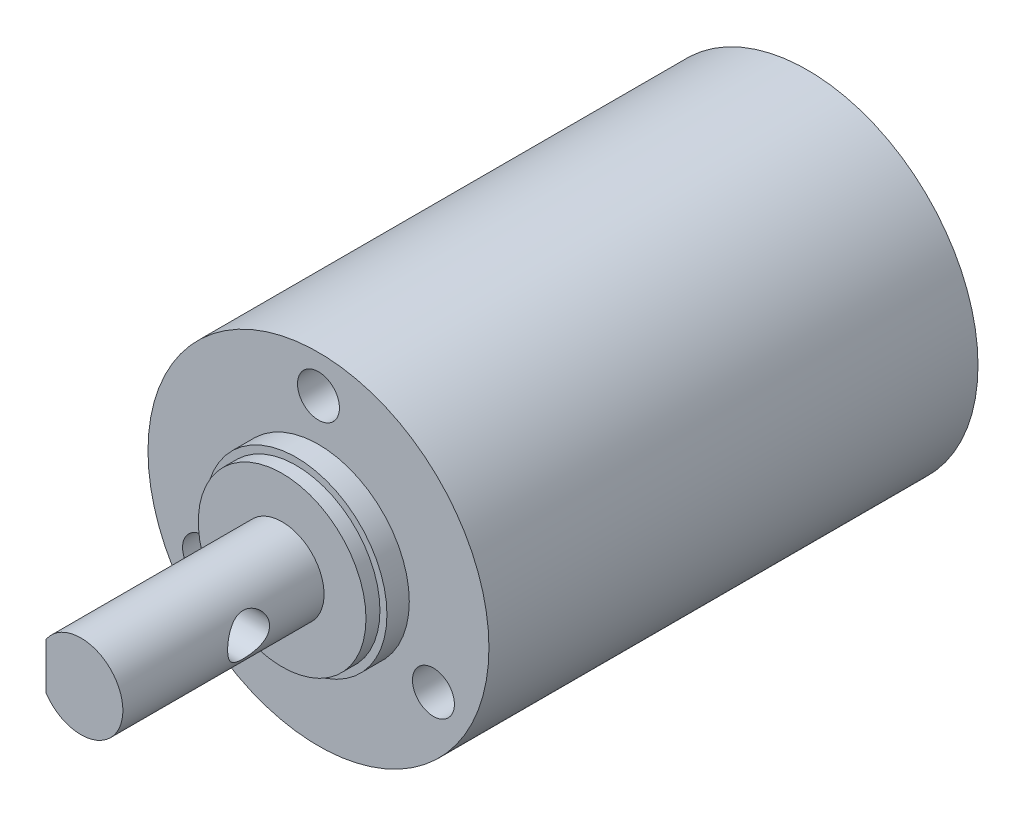
from build123d import *

# Parameters (mm, degrees)
SKETCH_1_R          = 12.2
EXTRUDE_1_DEPTH     = 35
SKETCH_2_R          = 6.5
EXTRUDE_2_DEPTH     = 2.6
EXTRUDE_3_DEPTH     = 14.4
CUT_EXTRUDE_START   = -1
SKETCH_4_R          = 6.5
SKETCH_4_R_2        = 6
CUT_EXTRUDE_2_DEPTH = 1
SKETCH_5_R          = 1.5
CUT_EXTRUDE_3_DEPTH = 56.397924149
SKETCH_6_R          = 1.5
CUT_EXTRUDE_5_DEPTH = 4


with BuildPart() as part:
    # 草图1 → 凸台-拉伸1 (new body)
    with BuildSketch(Plane.XY):
        Circle(SKETCH_1_R)
    extrude(amount=EXTRUDE_1_DEPTH)

    # 草图2 → 凸台-拉伸2 (add)
    with BuildSketch(Plane.XY.offset(35)):
        Circle(SKETCH_2_R)
    extrude(amount=EXTRUDE_2_DEPTH)

    # 草图3 → 凸台-拉伸3 (add)
    with BuildSketch(Plane.XY.offset(37.6)):
        with BuildLine():
            Line((-2.5, 1.658312395), (-2.5, -1.658312395))
            ThreePointArc((-2.5, -1.658312395), (3, 0), (-2.5, 1.658312395))
        make_face()
    extrude(amount=EXTRUDE_3_DEPTH)

    # 草图4 → 切除-拉伸2 (cut)
    with BuildSketch(Plane.XY.offset(37.6).offset(CUT_EXTRUDE_START)):
        Circle(SKETCH_4_R)
        Circle(SKETCH_4_R_2, mode=Mode.SUBTRACT)
    extrude(amount=CUT_EXTRUDE_2_DEPTH, mode=Mode.SUBTRACT)

    # 草图5 → 切除-拉伸3 (cut, through all)
    with BuildSketch(Plane.ZY.offset(2.5)):
        with Locations((43, 0)):
            Circle(SKETCH_5_R)
    extrude(amount=-CUT_EXTRUDE_3_DEPTH, mode=Mode.SUBTRACT)

    # 草图6 → 切除-拉伸5 (cut)
    with BuildSketch(Plane.XY.offset(35)):
        with Locations((0, 9.5)):
            Circle(SKETCH_6_R)
        with Locations((8.227241336, -4.75)):
            Circle(SKETCH_6_R)
        with Locations((-8.227241336, -4.75)):
            Circle(SKETCH_6_R)
    extrude(amount=-CUT_EXTRUDE_5_DEPTH, mode=Mode.SUBTRACT)


solid = part.part
